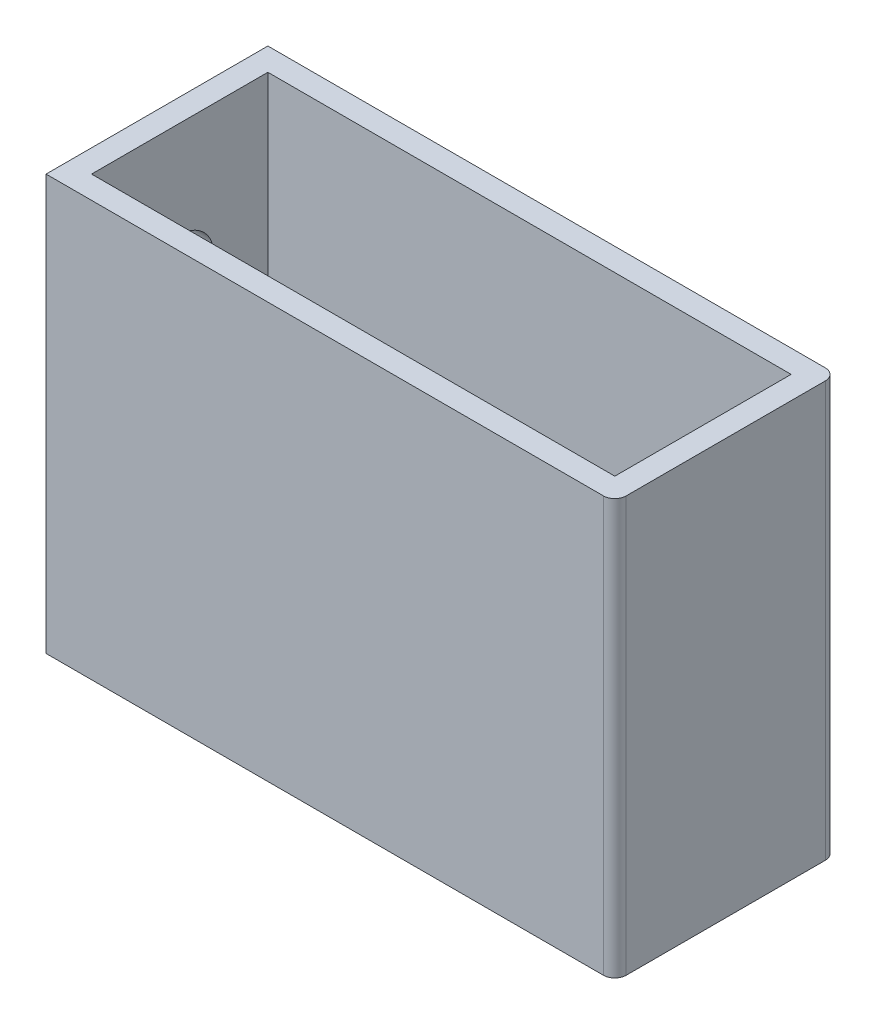
from build123d import *

# Parameters (mm, degrees)
SKETCH1_W           = 92
SKETCH1_H           = 31
BOSS_EXTRUDE2_DEPTH = 3
SKETCH1_3_W         = 100
SKETCH1_3_H         = 39
SKETCH1_3_W_2       = 92
SKETCH1_3_H_2       = 31
BOSS_EXTRUDE3_DEPTH = 73
FILLET1_R           = 2
FILLET2_R           = 2
SKETCH3_W           = 7.14
SKETCH3_H           = 31
BOSS_EXTRUDE4_DEPTH = 28
SKETCH4_W           = 7.14
SKETCH4_H           = 2.85103565
BOSS_EXTRUDE5_DEPTH = 4
SKETCH5_W           = 7.14
SKETCH5_H           = 5.56896435
CUT_EXTRUDE1_DEPTH  = 28
SKETCH4_3_R         = 0.5
CUT_EXTRUDE3_DEPTH  = 20
LPATTERN5_COUNT     = 2
LPATTERN5_PITCH     = 47.64
LPATTERN6_COUNT     = 2
LPATTERN6_PITCH     = 49
SKETCH10_W          = 2.85103565
SKETCH10_H          = 32
BOSS_EXTRUDE6_DEPTH = 41
SKETCH12_R          = 6
CUT_EXTRUDE4_DEPTH  = 10


with BuildPart() as part:
    # Sketch1 → Boss-Extrude2 (new body)
    with BuildSketch(Plane(origin=(0, 0, 0), x_dir=(1, 0, 0), z_dir=(0, 1, 0))):
        Rectangle(SKETCH1_W, SKETCH1_H)
    extrude(amount=BOSS_EXTRUDE2_DEPTH)

    # Sketch1<3> → Boss-Extrude3 (add)
    with BuildSketch(Plane(origin=(0, 0, 0), x_dir=(1, 0, 0), z_dir=(0, 1, 0))):
        Rectangle(SKETCH1_3_W, SKETCH1_3_H)
        Rectangle(SKETCH1_3_W_2, SKETCH1_3_H_2, mode=Mode.SUBTRACT)
    extrude(amount=BOSS_EXTRUDE3_DEPTH)

    # Fillet1
    fillet1_edges = [part.edges().sort_by_distance(p)[0] for p in [
        (50, 36.5, 19.5),
    ]]
    fillet(fillet1_edges, radius=FILLET1_R)

    # Fillet2
    fillet2_edges = [part.edges().sort_by_distance(p)[0] for p in [
        (50, 36.5, -19.5),
    ]]
    fillet(fillet2_edges, radius=FILLET2_R)

    # Sketch3 → Boss-Extrude4 (add)
    with BuildSketch(Plane(origin=(0, 3, 0), x_dir=(1, 0, 0), z_dir=(0, 1, 0))):
        with Locations((42.43, 0)):
            Rectangle(SKETCH3_W, SKETCH3_H)
    boss_extrude4 = extrude(amount=BOSS_EXTRUDE4_DEPTH)

    # Sketch4 → Boss-Extrude5 (add)
    with BuildSketch(Plane(origin=(0, 31, 0), x_dir=(1, 0, 0), z_dir=(0, 1, 0))):
        with Locations((42.43, -8.505517825)):
            Rectangle(SKETCH4_W, SKETCH4_H)
    boss_extrude5 = extrude(amount=BOSS_EXTRUDE5_DEPTH)

    # Sketch5 → Cut-Extrude1 (cut)
    with BuildSketch(Plane(origin=(0, 31, 0), x_dir=(1, 0, 0), z_dir=(0, 1, 0))):
        with Locations((42.43, -12.715517825)):
            Rectangle(SKETCH5_W, SKETCH5_H)
    cut_extrude1 = extrude(amount=-CUT_EXTRUDE1_DEPTH, mode=Mode.SUBTRACT)

    # Sketch4<3> → Cut-Extrude3 (cut)
    with BuildSketch(Plane(origin=(0, 31, 0), x_dir=(1, 0, 0), z_dir=(0, 1, 0))):
        with Locations((43.36, 8.92)):
            Circle(SKETCH4_3_R)
        with Locations((43.36, -1.08)):
            Circle(SKETCH4_3_R)
    cut_extrude3 = extrude(amount=-CUT_EXTRUDE3_DEPTH, mode=Mode.SUBTRACT)

    # LPattern5: Boss-Extrude4, Boss-Extrude5, Cut-Extrude1 ×2
    with Locations(*[(-i * LPATTERN5_PITCH, 0, 0) for i in range(1, LPATTERN5_COUNT)]):
        add(boss_extrude4)
        add(boss_extrude5)
        add(cut_extrude1, mode=Mode.SUBTRACT)

    # LPattern6: Cut-Extrude3 ×2
    with Locations(*[(-i * LPATTERN6_PITCH, 0, 0) for i in range(1, LPATTERN6_COUNT)]):
        add(cut_extrude3, mode=Mode.SUBTRACT)

    # Sketch10 → Boss-Extrude6 (add)
    with BuildSketch(Plane.ZY.offset(-38.86)):
        with Locations((8.505517825, 19)):
            Rectangle(SKETCH10_W, SKETCH10_H)
    extrude(amount=BOSS_EXTRUDE6_DEPTH)

    # Sketch12 → Cut-Extrude4 (cut)
    with BuildSketch(Plane(origin=(-46, 0, 0), x_dir=(0, 0, -1), z_dir=(1, 0, 0))):
        with Locations((0, 50)):
            Circle(SKETCH12_R)
    extrude(amount=-CUT_EXTRUDE4_DEPTH, mode=Mode.SUBTRACT)


solid = part.part
